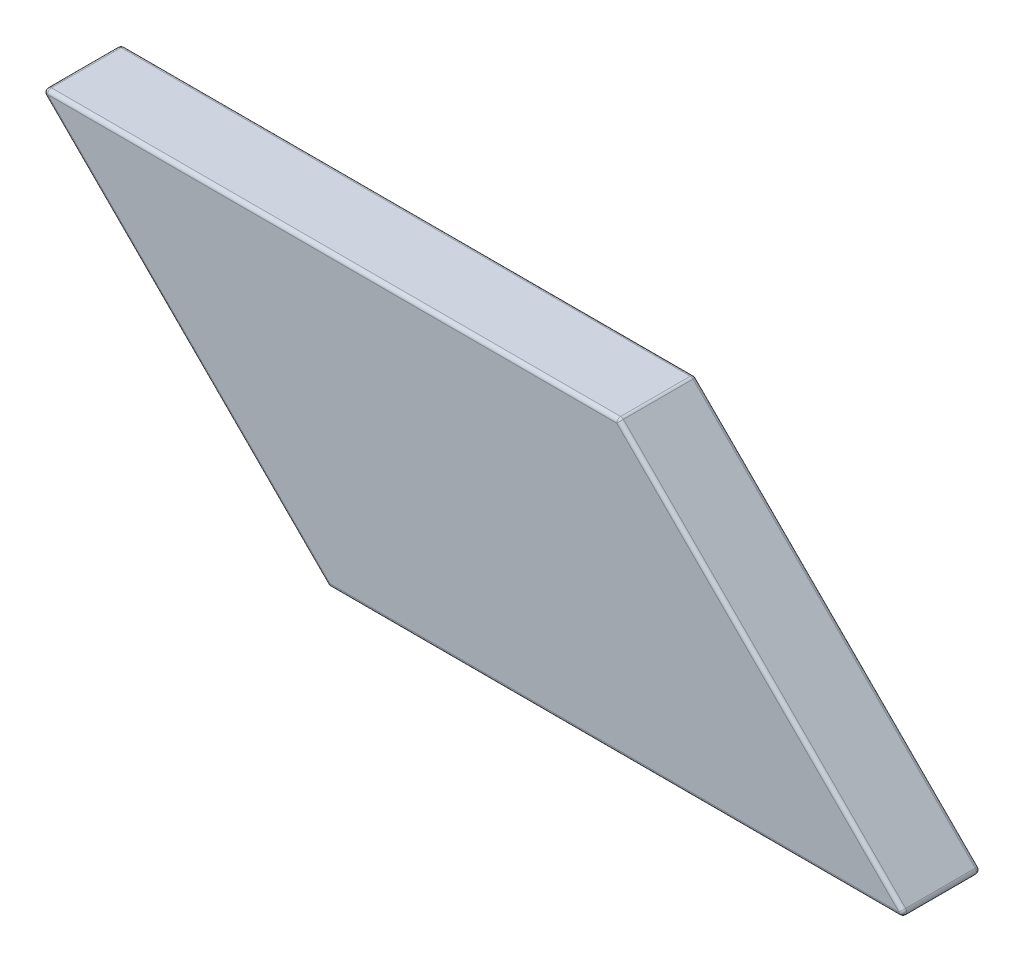
from build123d import *

# Parameters (mm, degrees)
EXTRUDE_1_DEPTH = 10
FILLET_1_R      = 0.5


with BuildPart() as part:
    # 草图1 → 凸台-拉伸1 (new body)
    with BuildSketch(Plane.XY):
        Polygon((-37.5, 37.5), (37.5, 37.5), (75, 0), (0, 0), align=None)
    extrude(amount=EXTRUDE_1_DEPTH)

    # 圆角1
    fillet_1_edges = [part.edges().sort_by_distance(p)[0] for p in [
        (0, 37.5, 10),
        (-18.75, 18.75, 10),
        (37.5, 0, 10),
        (-18.75, 18.75, 0),
        (0, 37.5, 0),
        (56.25, 18.75, 0),
        (37.5, 0, 0),
        (56.25, 18.75, 10),
        (0, 0, 5),
        (-37.5, 37.5, 5),
        (37.5, 37.5, 5),
        (75, 0, 5),
    ]]
    fillet(fillet_1_edges, radius=FILLET_1_R)


solid = part.part
